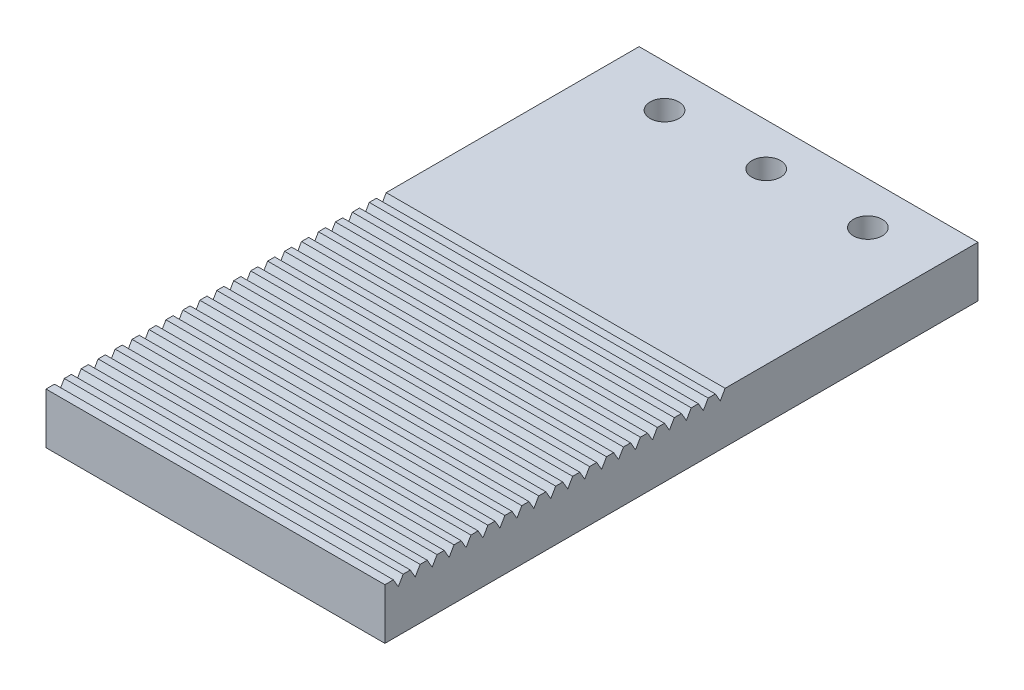
from build123d import *

# Parameters (mm, degrees)
SKETCH_1_W                = 40
SKETCH_1_H                = 70
EXTRUDE_1_DEPTH           = 6
CUT_EXTRUDE_1_DEPTH       = 54.488316481
HOLE_WIZARD_2_D           = 3.4
HOLE_WIZARD_2_CBORE_D     = 6
HOLE_WIZARD_2_CBORE_DEPTH = 3.4


with BuildPart() as part:
    # 草图1 → 凸台-拉伸1 (new body)
    with BuildSketch(Plane(origin=(0, 0, 0), x_dir=(1, 0, 0), z_dir=(0, 1, 0))):
        Rectangle(SKETCH_1_W, SKETCH_1_H)
    extrude(amount=EXTRUDE_1_DEPTH)

    # 草图4 → 切除-拉伸1 (cut, through all)
    with BuildSketch(Plane(origin=(20, 0, 0), x_dir=(0, 0, -1), z_dir=(1, 0, 0))):
        Polygon((-34, 6), (-33.422649731, 5), (-32.845299462, 6), align=None)
        Polygon((-32, 6), (-30.845299462, 6), (-31.422649731, 5), align=None)
        Polygon((-30, 6), (-28.845299462, 6), (-29.422649731, 5), align=None)
        Polygon((-28, 6), (-26.845299462, 6), (-27.422649731, 5), align=None)
        Polygon((-26, 6), (-24.845299462, 6), (-25.422649731, 5), align=None)
        Polygon((-24, 6), (-22.845299462, 6), (-23.422649731, 5), align=None)
        Polygon((-22, 6), (-20.845299462, 6), (-21.422649731, 5), align=None)
        Polygon((-20, 6), (-18.845299462, 6), (-19.422649731, 5), align=None)
        Polygon((-18, 6), (-16.845299462, 6), (-17.422649731, 5), align=None)
        Polygon((-16, 6), (-14.845299462, 6), (-15.422649731, 5), align=None)
        Polygon((-14, 6), (-12.845299462, 6), (-13.422649731, 5), align=None)
        Polygon((-12, 6), (-10.845299462, 6), (-11.422649731, 5), align=None)
        Polygon((-10, 6), (-8.845299462, 6), (-9.422649731, 5), align=None)
        Polygon((-8, 6), (-6.845299462, 6), (-7.422649731, 5), align=None)
        Polygon((-6, 6), (-4.845299462, 6), (-5.422649731, 5), align=None)
        Polygon((-4, 6), (-2.845299462, 6), (-3.422649731, 5), align=None)
        Polygon((-2, 6), (-0.845299462, 6), (-1.422649731, 5), align=None)
        Polygon((0, 6), (1.154700538, 6), (0.577350269, 5), align=None)
        Polygon((2, 6), (3.154700538, 6), (2.577350269, 5), align=None)
        Polygon((4, 6), (5.154700538, 6), (4.577350269, 5), align=None)
    extrude(amount=-CUT_EXTRUDE_1_DEPTH, mode=Mode.SUBTRACT)

    # 打孔尺寸(%根据)内六角圆柱头螺钉的类型2 (through all)
    with Locations(Plane(origin=(-12, 0, -30), x_dir=(0, 0, -1), z_dir=(0, -1, 0))):
        with Locations((0, 0), (0, 12), (0, 24)):
            CounterBoreHole(HOLE_WIZARD_2_D / 2, HOLE_WIZARD_2_CBORE_D / 2, HOLE_WIZARD_2_CBORE_DEPTH)


solid = part.part
